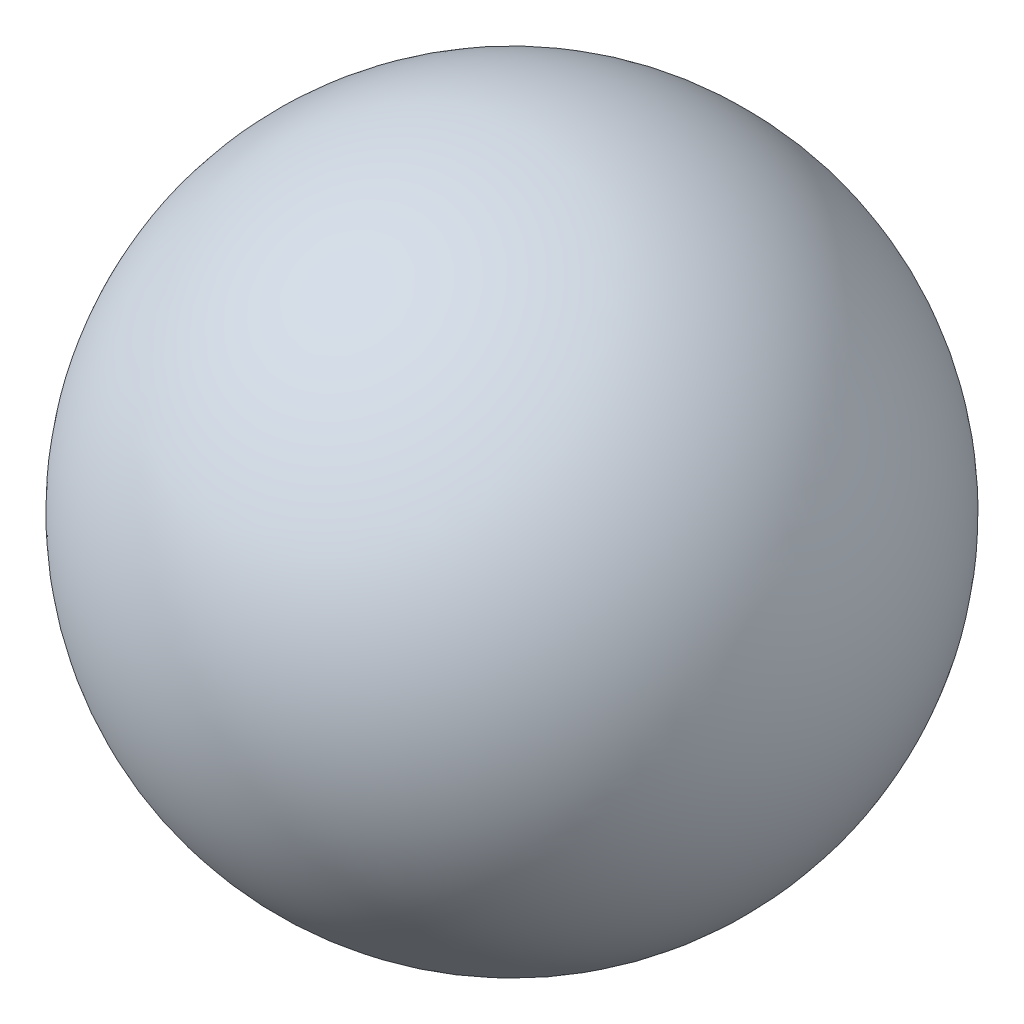
from build123d import *


with BuildPart() as part:
    # Esboço1 → Revolução1 (revolve)
    with BuildSketch(Plane.XY):
        with BuildLine():
            Line((-4.745, 0), (4.745, 0))
            ThreePointArc((4.745, 0), (0, 4.745), (-4.745, 0))
        make_face()
    revolve(axis=Axis((-4.745, 0, 0), (1, 0, 0)))


solid = part.part
